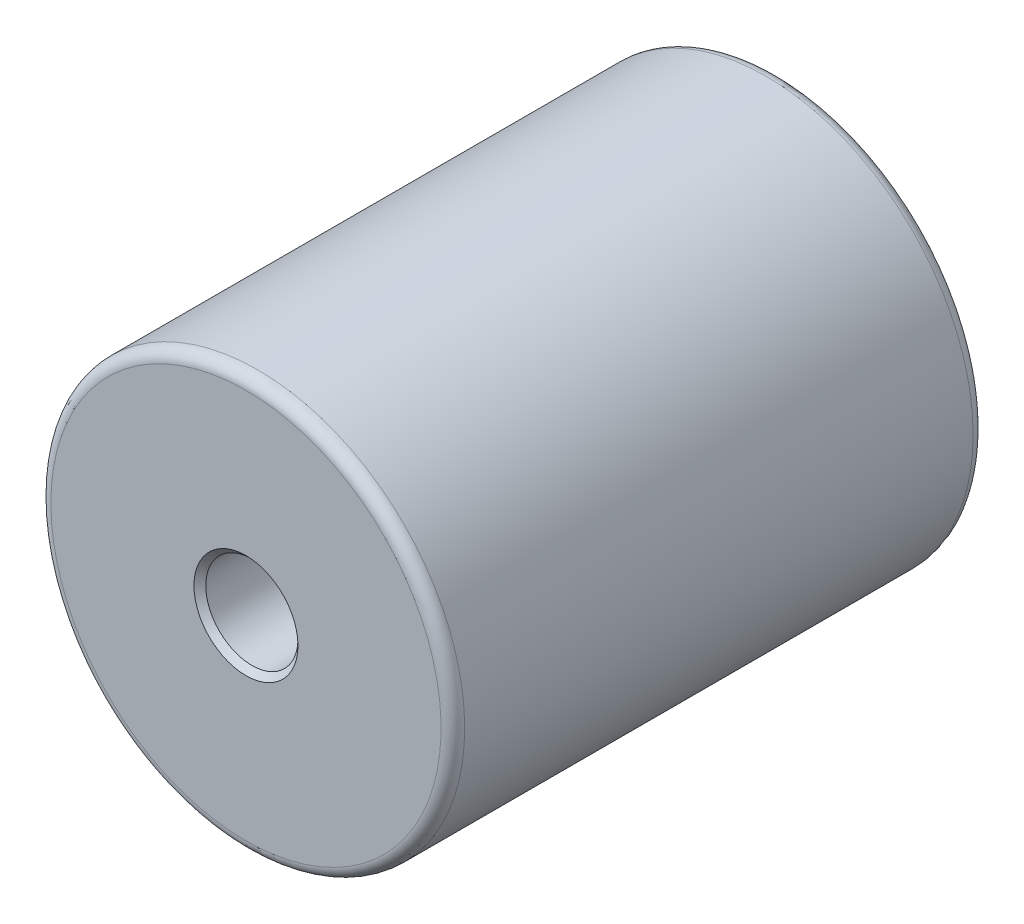
from build123d import *

# Parameters (mm, degrees)
EXTRUDE_1_DEPTH             = 5.5
SKETCH_2_R                  = 20
EXTRUDE_2_DEPTH             = 2
CHAMFER_1_SIZE              = 1.5
CHAMFER_1_SIZE2             = 1.787630389
CHAMFER_1_OF_MIRROR_1_SIZE2 = 1.5
CHAMFER_1_OF_MIRROR_1_SIZE  = 1.787630389
SKETCH_3_R                  = 3.4
CUT_EXTRUDE_1_DEPTH         = 30
SKETCH_8_R                  = 35
EXTRUDE_3_DEPTH             = 90
CUT_EXTRUDE_START           = -163
SKETCH_9_R                  = 3.4
CUT_EXTRUDE_2_DEPTH         = 163
FILLET_1_R                  = 2
SKETCH_10_R                 = 7.8
CUT_EXTRUDE_3_DEPTH         = 163
CHAMFER_2_SIZE              = 1
SKETCH_11_R                 = 106.702897297
CUT_EXTRUDE_4_DEPTH         = 322
CHAMFER_3_SIZE              = 1


with BuildPart() as part:
    # 스케치1 → 보스-돌출1 (new, symmetric)
    with BuildSketch(Plane.XY):
        with BuildLine():
            Line((12.279067203, 9.260056493), (13.72951471, 11.331510209))
            ThreePointArc((13.72951471, 11.331510209), (13.819231237, 11.644886966), (13.696740348, 11.946963163))
            ThreePointArc((13.696740348, 11.946963163), (12.880233507, 12.823034344), (12.007805037, 13.643432236))
            ThreePointArc((12.007805037, 13.643432236), (11.644638313, 13.792108644), (11.267252957, 13.684521298))
            Line((11.267252957, 13.684521298), (9.202645163, 12.238867358))
            ThreePointArc((9.202645163, 12.238867358), (8.915071795, 12.148443996), (8.627783828, 12.239770064))
            ThreePointArc((8.627783828, 12.239770064), (7.516754209, 12.951796446), (6.347354905, 13.563248531))
            ThreePointArc((6.347354905, 13.563248531), (6.081851507, 13.807041329), (6.003955886, 14.158977765))
            Line((6.003955886, 14.158977765), (6.224353416, 16.678133059))
            ThreePointArc((6.224353416, 16.678133059), (6.145361829, 16.994383555), (5.888243509, 17.194743772))
            ThreePointArc((5.888243509, 17.194743772), (4.743092252, 17.54519025), (3.577348088, 17.81946143))
            ThreePointArc((3.577348088, 17.81946143), (3.188498275, 17.766635614), (2.915466643, 17.484769561))
            Line((2.915466643, 17.484769561), (1.850290815, 15.200492627))
            ThreePointArc((1.850290815, 15.200492627), (1.646456756, 14.978397074), (1.351995179, 14.913843704))
            ThreePointArc((1.351995179, 14.913843704), (0.033801995, 14.974961851), (-1.284653671, 14.919795238))
            ThreePointArc((-1.284653671, 14.919795238), (-1.636482757, 14.998174295), (-1.879910562, 15.26401238))
            Line((-1.879910562, 15.26401238), (-2.948618349, 17.555863625))
            ThreePointArc((-2.948618349, 17.555863625), (-3.175152318, 17.790248795), (-3.498003423, 17.835206672))
            ThreePointArc((-3.498003423, 17.835206672), (-4.664956742, 17.566126596), (-5.811656393, 17.220780324))
            ThreePointArc((-5.811656393, 17.220780324), (-6.121997301, 16.980606919), (-6.217516604, 16.599987941))
            Line((-6.217516604, 16.599987941), (-5.997847464, 14.089158172))
            ThreePointArc((-5.997847464, 14.089158172), (-6.06332522, 13.794900649), (-6.286059898, 13.591765005))
            ThreePointArc((-6.286059898, 13.591765005), (-7.458207642, 12.985598321), (-8.572440333, 12.27859486))
            ThreePointArc((-8.572440333, 12.27859486), (-8.916322788, 12.170558572), (-9.260056493, 12.279067203))
            Line((-9.260056493, 12.279067203), (-11.331510209, 13.72951471))
            ThreePointArc((-11.331510209, 13.72951471), (-11.644886966, 13.819231237), (-11.946963163, 13.696740348))
            ThreePointArc((-11.946963163, 13.696740348), (-12.823034344, 12.880233507), (-13.643432236, 12.007805037))
            ThreePointArc((-13.643432236, 12.007805037), (-13.792108644, 11.644638313), (-13.684521298, 11.267252957))
            Line((-13.684521298, 11.267252957), (-12.238867358, 9.202645163))
            ThreePointArc((-12.238867358, 9.202645163), (-12.148443996, 8.915071795), (-12.239770064, 8.627783828))
            ThreePointArc((-12.239770064, 8.627783828), (-12.951796446, 7.516754209), (-13.563248531, 6.347354905))
            ThreePointArc((-13.563248531, 6.347354905), (-13.807041329, 6.081851507), (-14.158977765, 6.003955886))
            Line((-14.158977765, 6.003955886), (-16.678133059, 6.224353416))
            ThreePointArc((-16.678133059, 6.224353416), (-16.994383555, 6.145361829), (-17.194743772, 5.888243509))
            ThreePointArc((-17.194743772, 5.888243509), (-17.54519025, 4.743092252), (-17.81946143, 3.577348088))
            ThreePointArc((-17.81946143, 3.577348088), (-17.766635614, 3.188498275), (-17.484769561, 2.915466643))
            Line((-17.484769561, 2.915466643), (-15.200492627, 1.850290815))
            ThreePointArc((-15.200492627, 1.850290815), (-14.978397015, 1.646456653), (-14.913843726, 1.351994942))
            ThreePointArc((-14.913843726, 1.351994942), (-14.974961851, 0.033801876), (-14.919795238, -1.284653671))
            ThreePointArc((-14.919795238, -1.284653671), (-14.998174295, -1.636482757), (-15.26401238, -1.879910562))
            Line((-15.26401238, -1.879910562), (-17.555863625, -2.948618349))
            ThreePointArc((-17.555863625, -2.948618349), (-17.790248795, -3.175152318), (-17.835206672, -3.498003423))
            ThreePointArc((-17.835206672, -3.498003423), (-17.566126596, -4.664956742), (-17.220780324, -5.811656393))
            ThreePointArc((-17.220780324, -5.811656393), (-16.980606919, -6.121997301), (-16.599987941, -6.217516604))
            Line((-16.599987941, -6.217516604), (-14.089158172, -5.997847464))
            ThreePointArc((-14.089158172, -5.997847464), (-13.794900649, -6.06332522), (-13.591765005, -6.286059898))
            ThreePointArc((-13.591765005, -6.286059898), (-12.985598321, -7.458207642), (-12.27859486, -8.572440333))
            ThreePointArc((-12.27859486, -8.572440333), (-12.170558572, -8.916322788), (-12.279067203, -9.260056493))
            Line((-12.279067203, -9.260056493), (-13.72951471, -11.331510209))
            ThreePointArc((-13.72951471, -11.331510209), (-13.819231237, -11.644886966), (-13.696740348, -11.946963163))
            ThreePointArc((-13.696740348, -11.946963163), (-12.880233507, -12.823034344), (-12.007805037, -13.643432236))
            ThreePointArc((-12.007805037, -13.643432236), (-11.644638313, -13.792108644), (-11.267252957, -13.684521298))
            Line((-11.267252957, -13.684521298), (-9.202645163, -12.238867358))
            ThreePointArc((-9.202645163, -12.238867358), (-8.915071795, -12.148443996), (-8.627783828, -12.239770064))
            ThreePointArc((-8.627783828, -12.239770064), (-7.516754209, -12.951796446), (-6.347354905, -13.563248531))
            ThreePointArc((-6.347354905, -13.563248531), (-6.081851507, -13.807041329), (-6.003955886, -14.158977765))
            Line((-6.003955886, -14.158977765), (-6.224353416, -16.678133059))
            ThreePointArc((-6.224353416, -16.678133059), (-6.145361829, -16.994383555), (-5.888243509, -17.194743772))
            ThreePointArc((-5.888243509, -17.194743772), (-4.743092252, -17.54519025), (-3.577348088, -17.81946143))
            ThreePointArc((-3.577348088, -17.81946143), (-3.188498275, -17.766635614), (-2.915466643, -17.484769561))
            Line((-2.915466643, -17.484769561), (-1.850290815, -15.200492627))
            ThreePointArc((-1.850290815, -15.200492627), (-1.646456653, -14.978397015), (-1.351994942, -14.913843726))
            ThreePointArc((-1.351994942, -14.913843726), (-0.033801876, -14.974961851), (1.284653671, -14.919795238))
            ThreePointArc((1.284653671, -14.919795238), (1.636482757, -14.998174295), (1.879910562, -15.26401238))
            Line((1.879910562, -15.26401238), (2.948618349, -17.555863625))
            ThreePointArc((2.948618349, -17.555863625), (3.175152318, -17.790248795), (3.498003423, -17.835206672))
            ThreePointArc((3.498003423, -17.835206672), (4.664956742, -17.566126596), (5.811656393, -17.220780324))
            ThreePointArc((5.811656393, -17.220780324), (6.121997301, -16.980606919), (6.217516604, -16.599987941))
            Line((6.217516604, -16.599987941), (5.997847464, -14.089158172))
            ThreePointArc((5.997847464, -14.089158172), (6.06332522, -13.794900649), (6.286059898, -13.591765005))
            ThreePointArc((6.286059898, -13.591765005), (7.458207642, -12.985598321), (8.572440333, -12.27859486))
            ThreePointArc((8.572440333, -12.27859486), (8.916322788, -12.170558572), (9.260056493, -12.279067203))
            Line((9.260056493, -12.279067203), (11.331510209, -13.72951471))
            ThreePointArc((11.331510209, -13.72951471), (11.644886966, -13.819231237), (11.946963163, -13.696740348))
            ThreePointArc((11.946963163, -13.696740348), (12.823034344, -12.880233507), (13.643432236, -12.007805037))
            ThreePointArc((13.643432236, -12.007805037), (13.792108644, -11.644638313), (13.684521298, -11.267252957))
            Line((13.684521298, -11.267252957), (12.238867358, -9.202645163))
            ThreePointArc((12.238867358, -9.202645163), (12.148443996, -8.915071914), (12.239769926, -8.627784023))
            ThreePointArc((12.239769926, -8.627784023), (12.951796386, -7.516754312), (13.563248531, -6.347354905))
            ThreePointArc((13.563248531, -6.347354905), (13.807041329, -6.081851507), (14.158977765, -6.003955886))
            Line((14.158977765, -6.003955886), (16.678133059, -6.224353416))
            ThreePointArc((16.678133059, -6.224353416), (16.994383555, -6.145361829), (17.194743772, -5.888243509))
            ThreePointArc((17.194743772, -5.888243509), (17.54519025, -4.743092252), (17.81946143, -3.577348088))
            ThreePointArc((17.81946143, -3.577348088), (17.766635614, -3.188498275), (17.484769561, -2.915466643))
            Line((17.484769561, -2.915466643), (15.200492627, -1.850290815))
            ThreePointArc((15.200492627, -1.850290815), (14.978397015, -1.646456653), (14.913843726, -1.351994942))
            ThreePointArc((14.913843726, -1.351994942), (14.974961851, -0.033801876), (14.919795238, 1.284653671))
            ThreePointArc((14.919795238, 1.284653671), (14.998174295, 1.636482757), (15.26401238, 1.879910562))
            Line((15.26401238, 1.879910562), (17.555863625, 2.948618349))
            ThreePointArc((17.555863625, 2.948618349), (17.790248795, 3.175152318), (17.835206672, 3.498003423))
            ThreePointArc((17.835206672, 3.498003423), (17.566126596, 4.664956742), (17.220780324, 5.811656393))
            ThreePointArc((17.220780324, 5.811656393), (16.980606919, 6.121997301), (16.599987941, 6.217516604))
            Line((16.599987941, 6.217516604), (14.089158172, 5.997847464))
            ThreePointArc((14.089158172, 5.997847464), (13.794900649, 6.06332522), (13.591765005, 6.286059898))
            ThreePointArc((13.591765005, 6.286059898), (12.985598253, 7.458207762), (12.278594702, 8.572440559))
            ThreePointArc((12.278594702, 8.572440559), (12.170558572, 8.916322926), (12.279067203, 9.260056493))
        make_face()
    extrude(amount=EXTRUDE_1_DEPTH, both=True)

    # 스케치2 → 보스-돌출2 (add)
    with BuildSketch(Plane.XY.offset(5.5)):
        Circle(SKETCH_2_R)
    extrude_2 = extrude(amount=EXTRUDE_2_DEPTH)

    # 모따기1
    chamfer_1_edges = [part.edges().sort_by_distance(p)[0] for p in [
        (-20, 0, 5.5),
    ]]
    chamfer_1_side = [part.faces().sort_by_distance(p)[0] for p in [
        (-20, 0, 6.5),
    ]]
    chamfer(chamfer_1_edges, length=CHAMFER_1_SIZE, length2=CHAMFER_1_SIZE2, reference=chamfer_1_side[0])

    # 대칭 복사1: 보스-돌출2 across plane
    add(extrude_2.mirror(Plane.XY))

    # 모따기1 of 대칭 복사1
    chamfer_1_of_mirror_1_edges = [part.edges().sort_by_distance(p)[0] for p in [
        (-20, 0, -5.5),
    ]]
    chamfer(chamfer_1_of_mirror_1_edges, length=CHAMFER_1_OF_MIRROR_1_SIZE, length2=CHAMFER_1_OF_MIRROR_1_SIZE2)

    # 스케치3 → 컷-돌출1 (cut)
    with BuildSketch(Plane(origin=(0, 0, -7.5), x_dir=(-1, 0, 0), z_dir=(0, 0, -1))):
        Circle(SKETCH_3_R)
    extrude(amount=-CUT_EXTRUDE_1_DEPTH, mode=Mode.SUBTRACT)

    # 스케치8 → 보스-돌출3 (add)
    with BuildSketch(Plane(origin=(0, 0, -7.5), x_dir=(-1, 0, 0), z_dir=(0, 0, -1))):
        with Locations(Location((0, 0, 0), (0, 0, 180))):
            Circle(SKETCH_8_R)
    extrude(amount=EXTRUDE_3_DEPTH)

    # 스케치9 → 컷-돌출2 (cut)
    with BuildSketch(Plane.XY.offset(7.5).offset(CUT_EXTRUDE_START)):
        with Locations(Location((0, 0, 0), (0, 0, 180))):
            Circle(SKETCH_9_R)
    extrude(amount=CUT_EXTRUDE_2_DEPTH, mode=Mode.SUBTRACT)

    # 필렛1
    fillet_1_edges = [part.edges().sort_by_distance(p)[0] for p in [
        (-35, 0, -7.5),
        (-35, 0, -97.5),
    ]]
    fillet(fillet_1_edges, radius=FILLET_1_R)

    # 스케치10 → 컷-돌출3 (cut)
    with BuildSketch(Plane.XY.offset(7.5)):
        Circle(SKETCH_10_R)
    extrude(amount=-CUT_EXTRUDE_3_DEPTH, mode=Mode.SUBTRACT)

    # 모따기2
    chamfer_2_edges = [part.edges().sort_by_distance(p)[0] for p in [
        (-7.8, 0, 7.5),
        (-7.8, 0, -97.5),
    ]]
    chamfer(chamfer_2_edges, length=CHAMFER_2_SIZE)

    # 스케치11 → 컷-돌출4 (cut)
    with BuildSketch(Plane.XY.offset(-7.5)):
        Circle(SKETCH_11_R)
    extrude(amount=CUT_EXTRUDE_4_DEPTH, mode=Mode.SUBTRACT)

    # 모따기3
    chamfer_3_edges = [part.edges().sort_by_distance(p)[0] for p in [
        (-7.8, 0, -7.5),
    ]]
    chamfer(chamfer_3_edges, length=CHAMFER_3_SIZE)


solid = part.part
